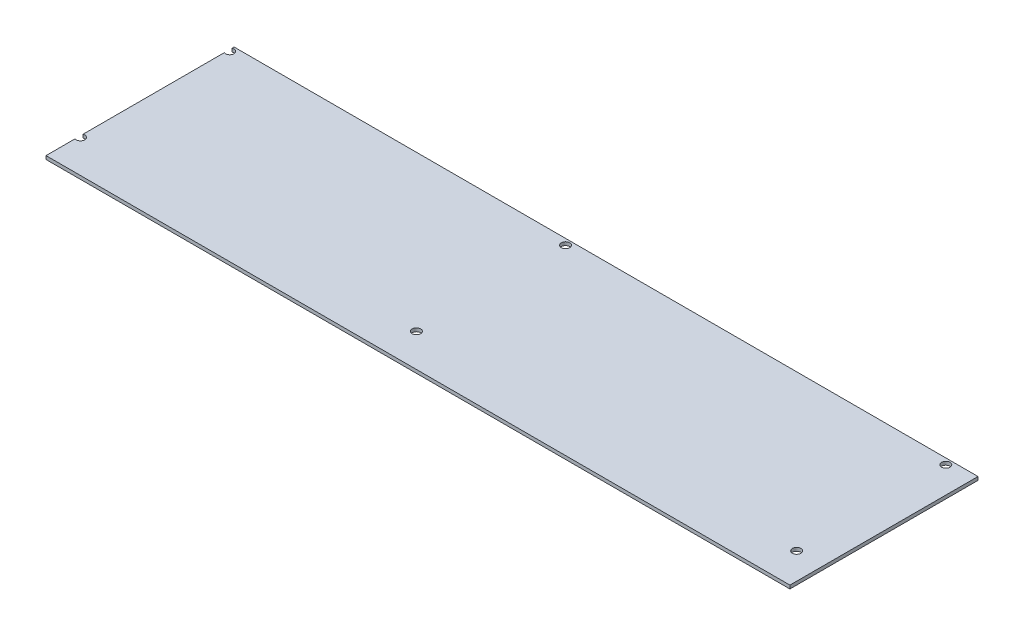
from build123d import *

# Parameters (mm, degrees)
SKETCH1_W               = 696.9125
SKETCH1_H               = 176.2125
BOSS_EXTRUDE1_DEPTH     = 3.175
CUT_EXTRUDE1_DEPTH      = 400.067894833
CUT_EXTRUDE1_DEPTH_BACK = 400.067894833
SKETCH2_R               = 3.96875


with BuildPart() as part:
    # Sketch1 → Boss-Extrude1 (new body)
    with BuildSketch(Plane(origin=(0, 0, 0), x_dir=(1, 0, 0), z_dir=(0, 1, 0))):
        with Locations((348.45625, -88.10625)):
            Rectangle(SKETCH1_W, SKETCH1_H)
    extrude(amount=BOSS_EXTRUDE1_DEPTH)

    # Sketch2 → Cut-Extrude1 (cut, two sides: drawn at the far end of the back side and taken through both)
    with BuildSketch(Plane(origin=(312.141503281, 3.175, 70.399532245), x_dir=(1, 0, 0), z_dir=(0, 1, 0)).offset(-CUT_EXTRUDE1_DEPTH_BACK)):
        with Locations(Location((360.164746719, 64.843282245, 0), (0, 0, 270))):
            Circle(SKETCH2_R)
        with Locations(Location((360.164746719, -74.856717755, 0), (0, 0, 270))):
            Circle(SKETCH2_R)
        with Locations(Location((3.908296933, 64.843282245, 0), (0, 0, 270))):
            Circle(SKETCH2_R)
        with Locations((-310.672178196, 64.843282245)):
            Circle(SKETCH2_R)
        with Locations(Location((3.908296933, -74.856717755, 0), (0, 0, 270))):
            Circle(SKETCH2_R)
        with Locations((-310.672178196, -74.856717755)):
            Circle(SKETCH2_R)
    extrude(amount=CUT_EXTRUDE1_DEPTH + CUT_EXTRUDE1_DEPTH_BACK, mode=Mode.SUBTRACT)


solid = part.part
